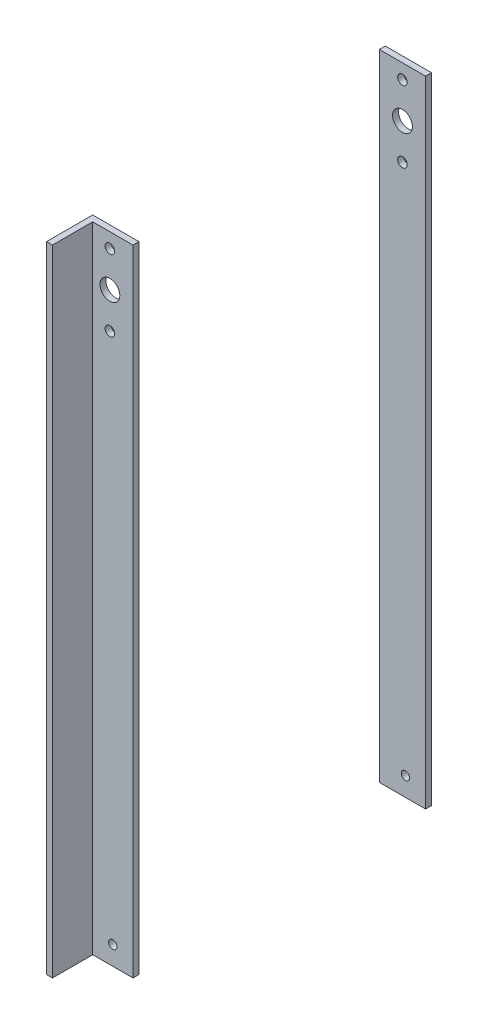
from build123d import *

# Parameters (mm, degrees)
SKETCH1_W               = 23.3
SKETCH1_H               = 320
BOSS_EXTRUDE1_DEPTH     = 3
SKETCH2_W               = 3
SKETCH2_H               = 320
BOSS_EXTRUDE2_DEPTH     = 20.3
CUT_EXTRUDE1_DEPTH      = 34.3
CUT_EXTRUDE1_DEPTH_BACK = 20.3
SKETCH3_R               = 5
SKETCH3_R_2             = 2.4
SKETCH5_W               = 23.3
SKETCH5_H               = 320
BOSS_EXTRUDE3_DEPTH     = 3
SKETCH6_W               = 3
SKETCH6_H               = 320
BOSS_EXTRUDE4_DEPTH     = 20.3
CUT_EXTRUDE2_START      = -20.3
SKETCH7_R               = 5
SKETCH7_R_2             = 2.4
CUT_EXTRUDE2_DEPTH      = 20.3
SKETCH9_R               = 2.1
CUT_EXTRUDE3_DEPTH      = 151
SKETCH10_W              = 20.3
SKETCH10_H              = 52
CUT_EXTRUDE4_DEPTH      = 151


with BuildPart() as part:
    # Sketch1 → Boss-Extrude1 (new body)
    with BuildSketch(Plane(origin=(0, 0, 0), x_dir=(0, 0, -1), z_dir=(1, 0, 0))):
        Rectangle(SKETCH1_W, SKETCH1_H)
    extrude(amount=BOSS_EXTRUDE1_DEPTH)

    # Sketch2 → Boss-Extrude2 (add)
    with BuildSketch(Plane(origin=(3, 0, 0), x_dir=(0, 0, -1), z_dir=(1, 0, 0))):
        with Locations((-10.15, 0)):
            Rectangle(SKETCH2_W, SKETCH2_H)
    extrude(amount=BOSS_EXTRUDE2_DEPTH)

    # Sketch3 → Cut-Extrude1 (cut, two sides: drawn at the far end of the back side and taken through both)
    with BuildSketch(Plane.XY.offset(11.65).offset(-CUT_EXTRUDE1_DEPTH_BACK)):
        with Locations(Location((11.65, 134.6, 0), (0, 0, 270))):
            Circle(SKETCH3_R)
        with Locations(Location((11.65, 152.6, 0), (0, 0, 270))):
            Circle(SKETCH3_R_2)
        with Locations(Location((11.65, 116.6, 0), (0, 0, 270))):
            Circle(SKETCH3_R_2)
    extrude(amount=CUT_EXTRUDE1_DEPTH + CUT_EXTRUDE1_DEPTH_BACK, mode=Mode.SUBTRACT)


with BuildPart() as body_2:
    # Sketch5 → Boss-Extrude3 (new body)
    with BuildSketch(Plane.XY.offset(156.15)):
        with Locations((11.65, 0)):
            Rectangle(SKETCH5_W, SKETCH5_H)
    extrude(amount=BOSS_EXTRUDE3_DEPTH)

    # Sketch6 → Boss-Extrude4 (add)
    with BuildSketch(Plane.XY.offset(159.15)):
        with Locations((1.5, 0)):
            Rectangle(SKETCH6_W, SKETCH6_H)
    extrude(amount=BOSS_EXTRUDE4_DEPTH)

    # Sketch7 → Cut-Extrude2 (cut)
    with BuildSketch(Plane(origin=(0, 0, 156.15), x_dir=(-1, 0, 0), z_dir=(0, 0, -1)).offset(CUT_EXTRUDE2_START)):
        with Locations((-11.65, 134.6)):
            Circle(SKETCH7_R)
        with Locations((-11.65, 116.6)):
            Circle(SKETCH7_R_2)
        with Locations((-11.65, 152.6)):
            Circle(SKETCH7_R_2)
    extrude(amount=CUT_EXTRUDE2_DEPTH, mode=Mode.SUBTRACT)


with BuildPart() as cut_extrude3_tool:
    # Sketch9 → Cut-Extrude3 (new body)
    with BuildSketch(Plane.XY.offset(159.15)):
        with Locations((13.15, -150.45)):
            Circle(SKETCH9_R)
    extrude(amount=-CUT_EXTRUDE3_DEPTH)


with BuildPart() as part_1:
    add(part.part)

    # Cut-Extrude3: cut by cut_extrude3_tool
    add(cut_extrude3_tool.part, mode=Mode.SUBTRACT)

    # Sketch10 → Cut-Extrude4 (cut)
    with BuildSketch(Plane(origin=(3, 0, 0), x_dir=(0, 0, -1), z_dir=(1, 0, 0))):
        with Locations((1.5, 134)):
            Rectangle(SKETCH10_W, SKETCH10_H)
    extrude(amount=-CUT_EXTRUDE4_DEPTH, mode=Mode.SUBTRACT)


with BuildPart() as body_2_1:
    add(body_2.part)

    # Cut-Extrude3: cut by cut_extrude3_tool
    add(cut_extrude3_tool.part, mode=Mode.SUBTRACT)


solid = Compound([part_1.part, body_2_1.part])
